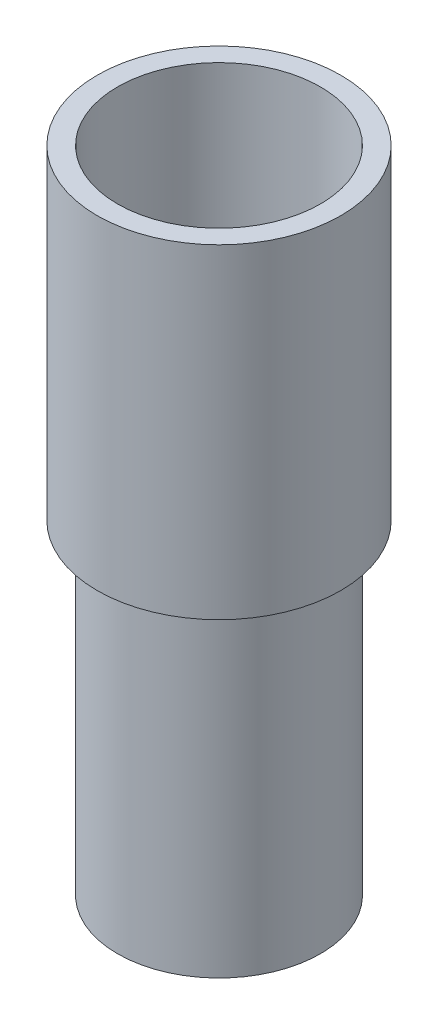
from build123d import *

# Parameters (mm, degrees)
SKETCH2_R                        = 9.525
SKETCH2_R_2                      = 7.9375
BOSS_EXTRUDE1_DEPTH              = 25.4
SKETCH2_3_R                      = 7.9375
BOSS_EXTRUDE2_DEPTH              = 25.4
F_5_8_0_625_DIAMETER_HOLE1_D     = 15.875
F_5_8_0_625_DIAMETER_HOLE1_DEPTH = 20.630668836
F_5_8_0_625_DIAMETER_HOLE1_TIP   = 4.769331164
F_1_2_0_5_DIAMETER_HOLE1_D       = 12.7


with BuildPart() as part:
    # Sketch2 → Boss-Extrude1 (new body)
    # profile 1 of 2: a face of its own
    with BuildSketch(Plane(origin=(0, 0, 0), x_dir=(1, 0, 0), z_dir=(0, 1, 0))):
        with Locations(Location((0, 0, 0), (0, 0, 270))):
            Circle(SKETCH2_R)
        Circle(SKETCH2_R_2, mode=Mode.SUBTRACT)
    # profile 2 of 2: a face of its own
    with BuildSketch(Plane(origin=(0, 0, 0), x_dir=(1, 0, 0), z_dir=(0, 1, 0))):
        Circle(SKETCH2_R_2)
    extrude(amount=BOSS_EXTRUDE1_DEPTH)

    # Sketch2<3> → Boss-Extrude2 (add)
    with BuildSketch(Plane(origin=(0, 0, 0), x_dir=(1, 0, 0), z_dir=(0, 1, 0))):
        with Locations(Location((0, 0, 0), (0, 0, 270))):
            Circle(SKETCH2_3_R)
    extrude(amount=-BOSS_EXTRUDE2_DEPTH)

    # 5/8 (0.625) Diameter Hole1
    with Locations(Plane(origin=(0, 25.4, 0), x_dir=(1, 0, 0), z_dir=(0, 1, 0))):
        with Locations((0, 0)):
            Hole(F_5_8_0_625_DIAMETER_HOLE1_D / 2, depth=F_5_8_0_625_DIAMETER_HOLE1_DEPTH)
            with Locations((0, 0, -(F_5_8_0_625_DIAMETER_HOLE1_DEPTH + F_5_8_0_625_DIAMETER_HOLE1_TIP / 2))):  # 118° drill point
                Cone(0, F_5_8_0_625_DIAMETER_HOLE1_D / 2, F_5_8_0_625_DIAMETER_HOLE1_TIP, mode=Mode.SUBTRACT)

    # 1/2 (0.5) Diameter Hole1 (through all)
    with Locations(Plane(origin=(0, -25.4, 0), x_dir=(-1, 0, 0), z_dir=(0, -1, 0))):
        with Locations((0, 0)):
            Hole(F_1_2_0_5_DIAMETER_HOLE1_D / 2)


solid = part.part
